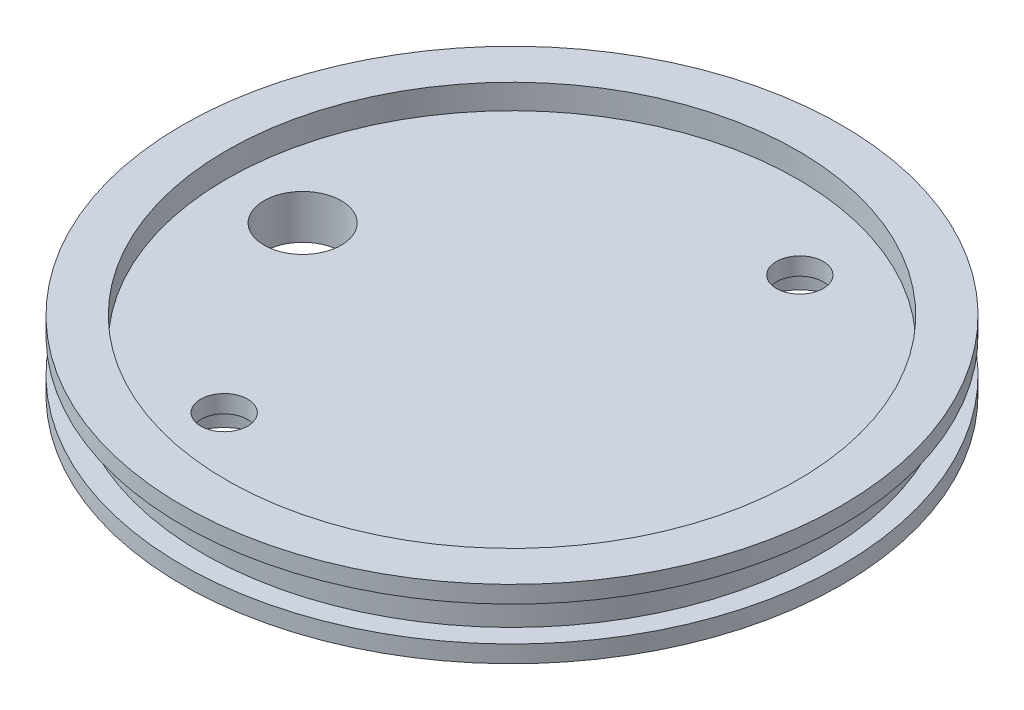
from build123d import *

# Parameters (mm, degrees)
TAP_DRILL_FOR_1_4_TAP_1_4_18_NPT_D                   = 11.1252
CBORE_FOR_1_4_BINDING_HEAD_MACHINE_SCREW_D           = 6.7564
CBORE_FOR_1_4_BINDING_HEAD_MACHINE_SCREW_CBORE_D     = 12.7
CBORE_FOR_1_4_BINDING_HEAD_MACHINE_SCREW_CBORE_DEPTH = 3.81


with BuildPart() as part:
    # Sketch1 → Revolve1 (revolve)
    with BuildSketch(Plane.XY, mode=Mode.PRIVATE) as revolve1_sk:
        Polygon((0, 0), (47.498, 0), (47.498, 2.4638), (44.577, 2.4638), (44.577, 7.4422), (47.498, 7.4422), (47.498, 9.906), (41.148, 9.906), (41.148, 6.35), (0, 6.35), align=None)
    revolve(revolve1_sk.sketch.rotate(Axis((0, 48.192213231, 0), (0, -1, 0)), 180), axis=Axis((0, 48.192213231, 0), (0, -1, 0)))

    # Tap Drill for 1/4 Tap - 1/4-18 NPT (through all)
    with Locations(Plane(origin=(0, 6.35, 0), x_dir=(1, 0, 0), z_dir=(0, 1, 0))):
        with Locations((-30.1752, 0)):
            Hole(TAP_DRILL_FOR_1_4_TAP_1_4_18_NPT_D / 2)

    # CBORE for 1/4 Binding Head Machine Screw1 (through all)
    with Locations(Plane.XZ):
        with Locations((12.150198978, -29.333175157), (-12.150198978, 29.333175157)):
            CounterBoreHole(CBORE_FOR_1_4_BINDING_HEAD_MACHINE_SCREW_D / 2, CBORE_FOR_1_4_BINDING_HEAD_MACHINE_SCREW_CBORE_D / 2, CBORE_FOR_1_4_BINDING_HEAD_MACHINE_SCREW_CBORE_DEPTH)


solid = part.part
